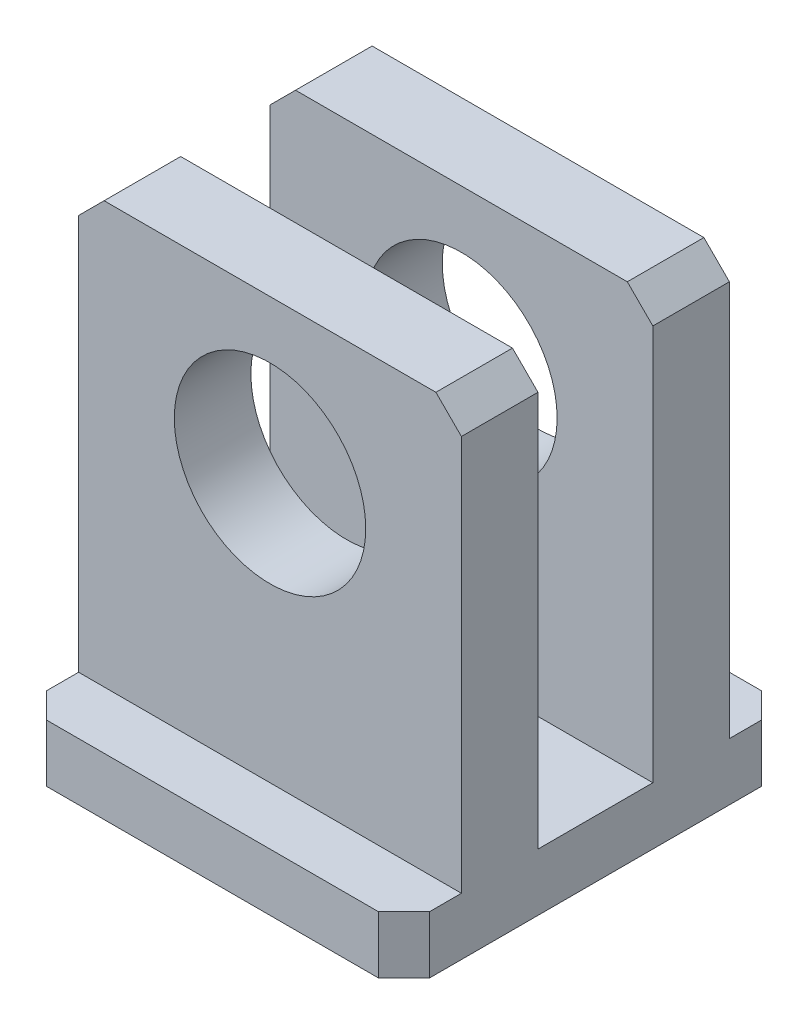
from build123d import *

# Parameters (mm, degrees)
EXTRUDE_1_DEPTH     = 4.5
SKETCH_2_W          = 30
SKETCH_2_H          = 21
EXTRUDE_2_DEPTH     = 33
SKETCH_3_W          = 30
SKETCH_3_H          = 9
CUT_EXTRUDE_1_DEPTH = 33
SKETCH_4_R          = 7.5
CUT_EXTRUDE_2_DEPTH = 48.765049984
CUT_EXTRUDE_6_DEPTH = 48.765049984


with BuildPart() as part:
    # 草图1 → 凸台-拉伸1 (new body)
    with BuildSketch(Plane(origin=(0, 0, 0), x_dir=(1, 0, 0), z_dir=(0, 1, 0))):
        Polygon((-15, 13), (-13, 15), (13, 15), (15, 13), (15, -13), (13, -15), (-13, -15), (-15, -13), align=None)
    extrude(amount=EXTRUDE_1_DEPTH)

    # 草图2 → 凸台-拉伸2 (add)
    with BuildSketch(Plane(origin=(0, 4.5, 0), x_dir=(1, 0, 0), z_dir=(0, 1, 0))):
        Rectangle(SKETCH_2_W, SKETCH_2_H)
    extrude(amount=EXTRUDE_2_DEPTH)

    # 草图3 → 切除-拉伸1 (cut)
    with BuildSketch(Plane(origin=(0, 37.5, 0), x_dir=(1, 0, 0), z_dir=(0, 1, 0))):
        Rectangle(SKETCH_3_W, SKETCH_3_H)
    extrude(amount=-CUT_EXTRUDE_1_DEPTH, mode=Mode.SUBTRACT)

    # 草图4 → 切除-拉伸2 (cut, through all)
    with BuildSketch(Plane.XY.offset(10.5)):
        with Locations((0, 25.5)):
            Circle(SKETCH_4_R)
    extrude(amount=-CUT_EXTRUDE_2_DEPTH, mode=Mode.SUBTRACT)

    # 草图9 → 切除-拉伸6 (cut, through all)
    with BuildSketch(Plane.XY.offset(10.5)):
        Polygon((-15, 35.5), (-13, 37.5), (-15, 37.5), align=None)
        Polygon((13, 37.5), (15, 35.5), (15, 37.5), align=None)
    extrude(amount=-CUT_EXTRUDE_6_DEPTH, mode=Mode.SUBTRACT)


solid = part.part
